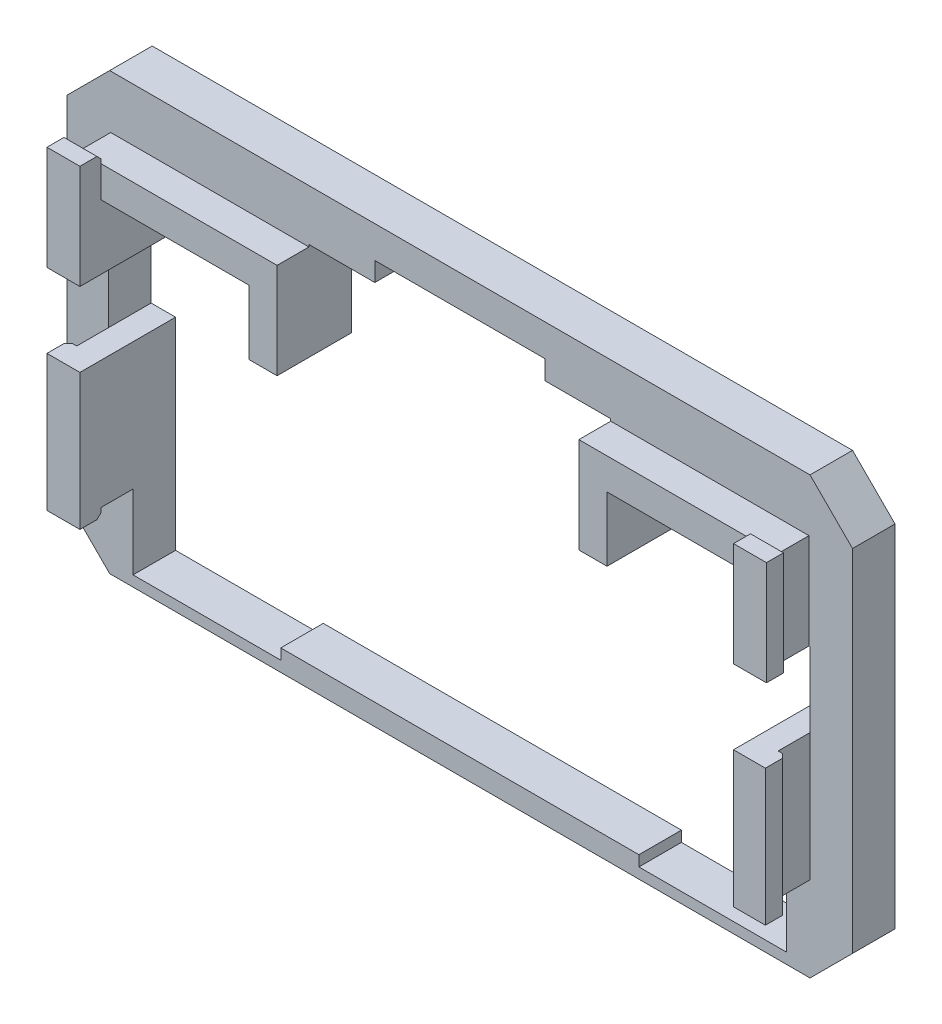
from build123d import *

# Parameters (mm, degrees)
SKETCH2_W           = 30.751006124
SKETCH2_H           = 0.5
SKETCH2_W_2         = 3.100075991
SKETCH2_H_2         = 10.000695173
SKETCH2_W_3         = 2
SKETCH2_H_3         = 3.50017022
SKETCH2_W_4         = 1.95
BOSS_EXTRUDE1_DEPTH = 2
SKETCH3_W           = 1.150075991
SKETCH3_H           = 6.000695173
SKETCH3_W_2         = 1.100075991
BOSS_EXTRUDE2_DEPTH = 1.5
SKETCH4_W           = 1.550075991
SKETCH4_H           = 4.899134607
SKETCH4_H_2         = 6.400695173
SKETCH4_W_2         = 1.500075991
BOSS_EXTRUDE3_DEPTH = 1
CHAMFER1_SIZE       = 0.2
CUT_EXTRUDE1_START  = -2
SKETCH5_W           = 3.300200616
SKETCH5_H           = 1
SKETCH5_W_2         = 3.300200617
CUT_EXTRUDE1_DEPTH  = 2
SKETCH8_W           = 16.850185419
SKETCH8_H           = 0.5
BOSS_EXTRUDE4_DEPTH = 2
CHAMFER2_SIZE       = 2


with BuildPart() as part:
    # Sketch2 → Boss-Extrude1 (new body)
    with BuildSketch(Plane.XY):
        Polygon((277.431409328, 90.45473243), (281.431409328, 90.45473243), (281.431409328, 91.95473243), (262.955830275, 91.95473243), (262.955830275, 84.955597823), (264.905830275, 84.955597823), (266.055906266, 84.955597823), (266.055906266, 87.985794184), (273.006316619, 87.985794184), (273.006316619, 84.955597823), (274.331409328, 84.955597823), (274.331409328, 89.55473243), (277.431409328, 89.55473243), align=None)
        Polygon((281.431409328, 91.95473243), (281.431409328, 90.45473243), (285.431409328, 90.45473243), (285.431409328, 89.55473243), (288.531409328, 89.55473243), (288.531409328, 84.955597823), (289.856502038, 84.955597823), (289.856502038, 87.985794184), (296.80691239, 87.985794184), (296.80691239, 84.955597823), (297.906988381, 84.955597823), (299.906988381, 84.955597823), (299.906988381, 91.95473243), align=None)
        with Locations((281.431409328, 71.70473243)):
            Rectangle(SKETCH2_W, SKETCH2_H)
        with Locations((264.505868271, 76.455080017)):
            Rectangle(SKETCH2_W_2, SKETCH2_H_2)
        Polygon((299.906988381, 71.45473243), (299.906988381, 81.455427603), (297.906988381, 81.455427603), (296.80691239, 81.455427603), (296.80691239, 71.95473243), (296.80691239, 71.45473243), align=None)
        with Locations((298.906988381, 83.205512713)):
            Rectangle(SKETCH2_W_3, SKETCH2_H_3)
        with Locations((263.930830275, 83.205512713)):
            Rectangle(SKETCH2_W_4, SKETCH2_H_3)
    extrude(amount=-BOSS_EXTRUDE1_DEPTH)

    # Sketch3 → Boss-Extrude2 (add)
    with BuildSketch(Plane.XY):
        Polygon((265.005830275, 84.955597823), (266.055906266, 84.955597823), (266.055906266, 87.985794184), (273.006316619, 87.985794184), (273.006316619, 84.955597823), (274.331409328, 84.955597823), (274.331409328, 89.45473243), (265.005830275, 89.45473243), align=None)
        with Locations((265.480868271, 78.455080017)):
            Rectangle(SKETCH3_W, SKETCH3_H)
        with Locations((297.356950385, 78.455080017)):
            Rectangle(SKETCH3_W_2, SKETCH3_H)
        Polygon((288.531409328, 89.45473243), (288.531409328, 84.955597823), (289.856502038, 84.955597823), (289.856502038, 87.985794184), (296.80691239, 87.985794184), (296.80691239, 84.955597823), (297.856988381, 84.955597823), (297.856988381, 89.45473243), align=None)
    extrude(amount=BOSS_EXTRUDE2_DEPTH)

    # Sketch4 → Boss-Extrude3 (add)
    with BuildSketch(Plane.XY.offset(1.5)):
        with Locations((265.280868271, 87.405165127)):
            Rectangle(SKETCH4_W, SKETCH4_H)
        with Locations((265.280868271, 78.255080017)):
            Rectangle(SKETCH4_W, SKETCH4_H_2)
        with Locations((297.556950386, 78.255080017)):
            Rectangle(SKETCH4_W_2, SKETCH4_H_2)
        with Locations((297.581950386, 87.405165127)):
            Rectangle(SKETCH4_W, SKETCH4_H)
    extrude(amount=BOSS_EXTRUDE3_DEPTH)

    # Chamfer1
    chamfer1_edges = [part.edges().sort_by_distance(p)[0] for p in [
        (298.356988381, 87.405165127, 1.5),
        (297.581950386, 89.85473243, 1.5),
        (297.556950386, 75.05473243, 1.5),
        (298.306988381, 78.255080016, 1.5),
        (265.280868271, 75.05473243, 1.5),
        (264.505830275, 78.255080016, 1.5),
        (265.280868271, 89.85473243, 1.5),
        (264.505830275, 87.405165127, 1.5),
    ]]
    chamfer(chamfer1_edges, length=CHAMFER1_SIZE)

    # Sketch5 → Cut-Extrude1 (cut)
    with BuildSketch(Plane(origin=(0, 0, -2), x_dir=(-1, 0, 0), z_dir=(0, 0, -1)).offset(CUT_EXTRUDE1_START)):
        with Locations((-269.530111382, 88.485794184)):
            Rectangle(SKETCH5_W, SKETCH5_H)
        with Locations((-293.332707275, 88.485794184)):
            Rectangle(SKETCH5_W_2, SKETCH5_H)
    extrude(amount=CUT_EXTRUDE1_DEPTH, mode=Mode.SUBTRACT)

    # Sketch8 → Boss-Extrude4 (add)
    with BuildSketch(Plane(origin=(0, 0, -2), x_dir=(-1, 0, 0), z_dir=(0, 0, -1))):
        with Locations((-281.431409329, 72.20473243)):
            Rectangle(SKETCH8_W, SKETCH8_H)
    extrude(amount=-BOSS_EXTRUDE4_DEPTH)

    # Chamfer2
    chamfer2_edges = [part.edges().sort_by_distance(p)[0] for p in [
        (262.955830275, 91.95473243, -1),
        (299.906988381, 91.95473243, -1),
        (262.955830275, 71.45473243, -1),
        (299.906988381, 71.45473243, -1),
    ]]
    chamfer(chamfer2_edges, length=CHAMFER2_SIZE)


solid = part.part
